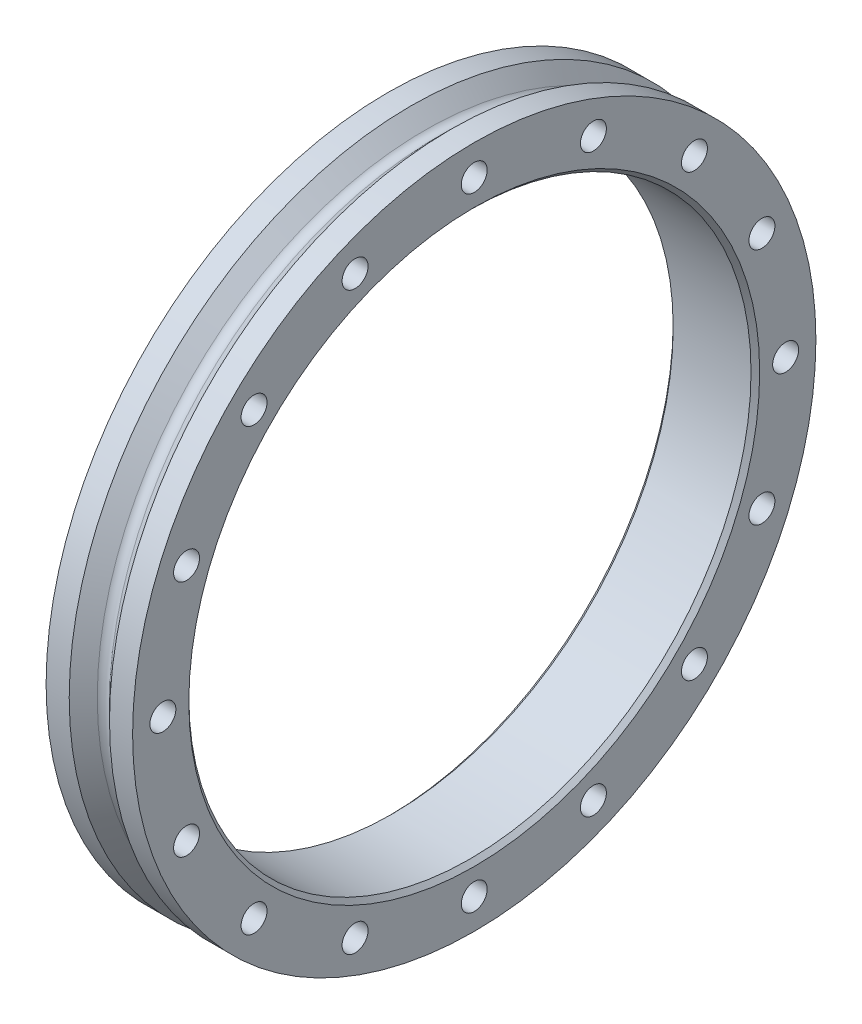
from build123d import *

# Parameters (mm, degrees)
CHAMFER1_SIZE      = 1
FILLET1_R          = 2
SKETCH2_R          = 3
CUT_EXTRUDE1_DEPTH = 114.498898812
CIRPATTERN1_COUNT  = 16


with BuildPart() as part:
    # Sketch1 → Revolve1 (revolve)
    with BuildSketch(Plane.XY):
        Polygon((10, 79), (4.656854249, 79), (0, 74.343145751), (-4.656854249, 79), (-10, 79), (-10, 65), (10, 65), align=None)
    revolve(axis=Axis((-42.067307692, 0, 0), (1, 0, 0)))

    # Chamfer1
    chamfer1_edges = [part.edges().sort_by_distance(p)[0] for p in [
        (10, -65, 0),
        (-10, -65, 0),
    ]]
    chamfer(chamfer1_edges, length=CHAMFER1_SIZE)

    # Fillet1
    fillet1_edges = [part.edges().sort_by_distance(p)[0] for p in [
        (0, -74.343145751, 0),
    ]]
    fillet(fillet1_edges, radius=FILLET1_R)

    # Sketch2 → Cut-Extrude1 (cut, through all)
    with BuildSketch(Plane(origin=(10, 0, 0), x_dir=(0, 0, -1), z_dir=(1, 0, 0))):
        with Locations((0, 72)):
            Circle(SKETCH2_R)
    cut_extrude1 = extrude(amount=-CUT_EXTRUDE1_DEPTH, mode=Mode.SUBTRACT)

    # CirPattern1: Cut-Extrude1 ×16 about axis
    cirpattern1_axis = Axis((10, 0, 0), (-1, 0, 0))
    for i in range(1, CIRPATTERN1_COUNT):
        add(cut_extrude1.rotate(cirpattern1_axis, i * 360 / CIRPATTERN1_COUNT), mode=Mode.SUBTRACT)


solid = part.part
